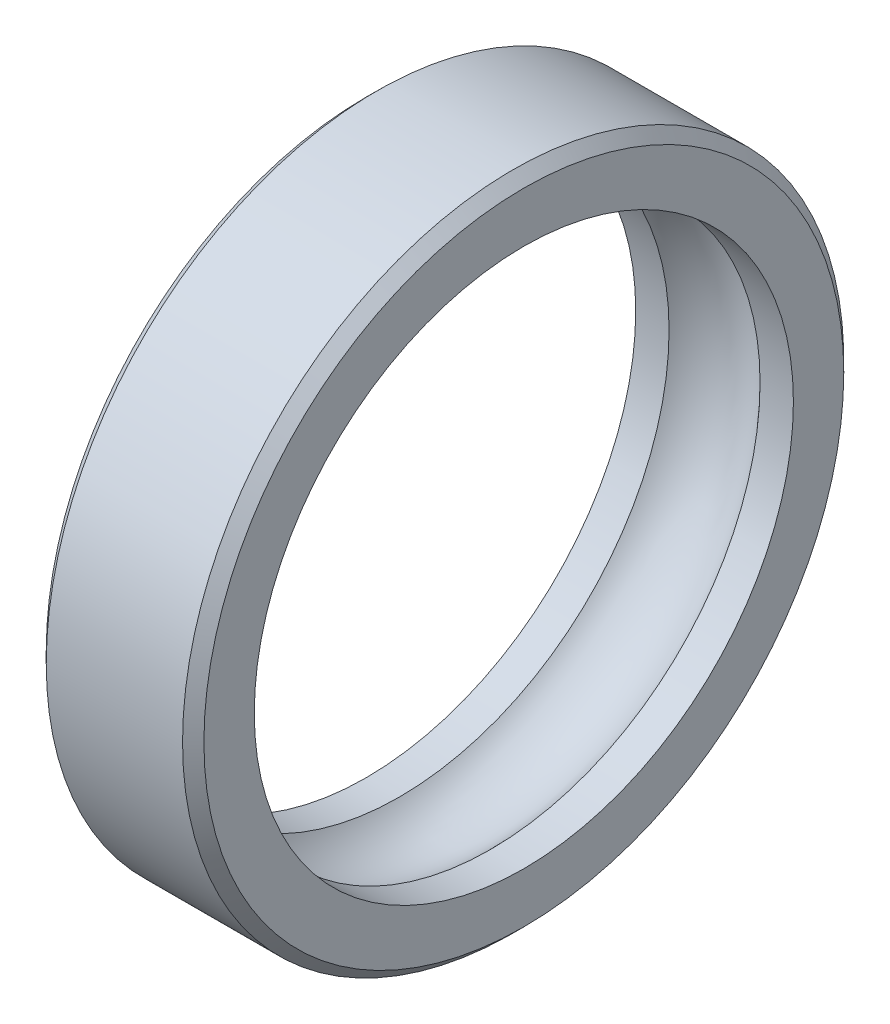
from build123d import *

# Parameters (mm, degrees)
CHAMFER1_SIZE = 2.1


with BuildPart() as part:
    # Sketch1 → Revolve1 (revolve)
    with BuildSketch(Plane.XY, mode=Mode.PRIVATE) as revolve1_sk:
        with BuildLine():
            Line((-15.5, 65), (15.5, 65))
            Line((15.5, 65), (15.5, 53))
            Line((15.5, 53), (8.94427191, 53))
            ThreePointArc((8.94427191, 53), (0, 57), (-8.94427191, 53))
            Line((-8.94427191, 53), (-15.5, 53))
            Line((-15.5, 53), (-15.5, 65))
        make_face()
    revolve(revolve1_sk.sketch.rotate(Axis((-15.020068807, 0, 0), (1, 0, 0)), 90), axis=Axis((-15.020068807, 0, 0), (1, 0, 0)))

    # Chamfer1
    chamfer1_edges = [part.edges().sort_by_distance(p)[0] for p in [
        (-15.5, 0, -65),
        (15.5, 0, -65),
    ]]
    chamfer(chamfer1_edges, length=CHAMFER1_SIZE)


solid = part.part
